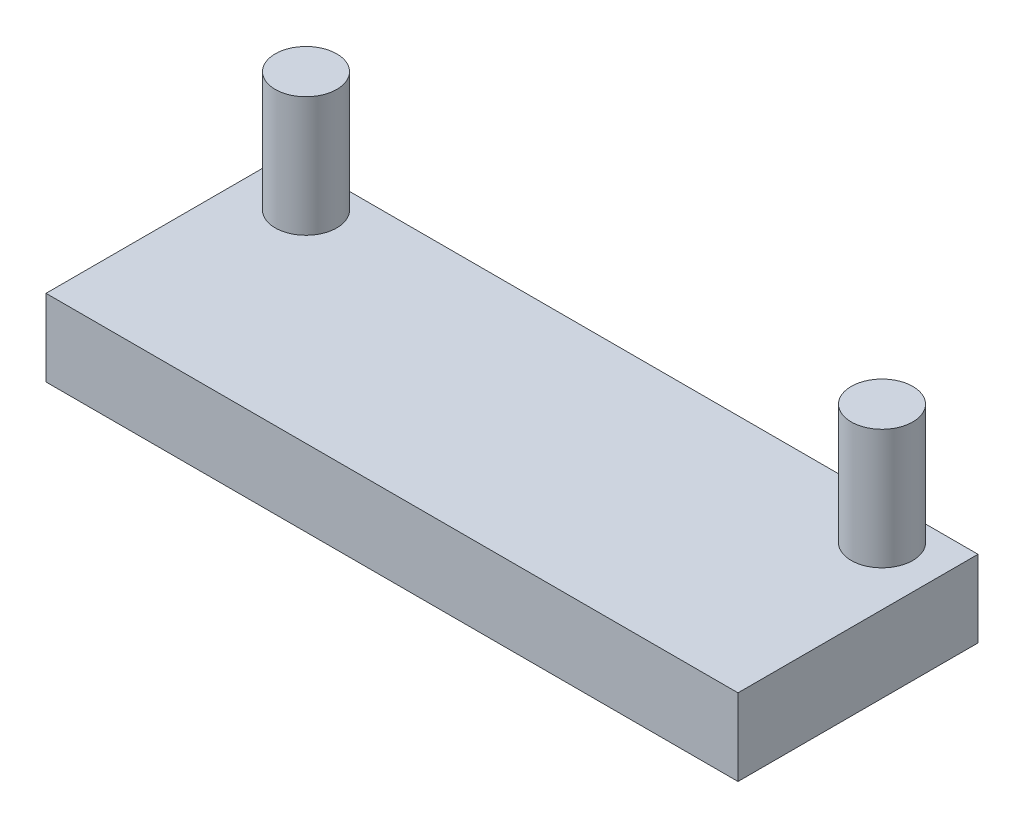
from build123d import *

# Parameters (mm, degrees)
SKETCH1_W           = 21.971
SKETCH1_H           = 7.62
BOSS_EXTRUDE1_DEPTH = 2.4384
SKETCH2_R           = 0.9779
BOSS_EXTRUDE2_DEPTH = 3.81


with BuildPart() as part:
    # Sketch1 → Boss-Extrude1 (new body)
    with BuildSketch(Plane(origin=(0, 0, 0), x_dir=(1, 0, 0), z_dir=(0, 1, 0))):
        Rectangle(SKETCH1_W, SKETCH1_H)
    extrude(amount=BOSS_EXTRUDE1_DEPTH)

    # Sketch2 → Boss-Extrude2 (add)
    with BuildSketch(Plane(origin=(0, 2.4384, 0), x_dir=(1, 0, 0), z_dir=(0, 1, 0))):
        with Locations(Location((-9.144, 2.603752038, 0), (0, 0, 90))):
            Circle(SKETCH2_R)
        with Locations(Location((9.144, 2.603752038, 0), (0, 0, 90))):
            Circle(SKETCH2_R)
    extrude(amount=BOSS_EXTRUDE2_DEPTH)


solid = part.part
